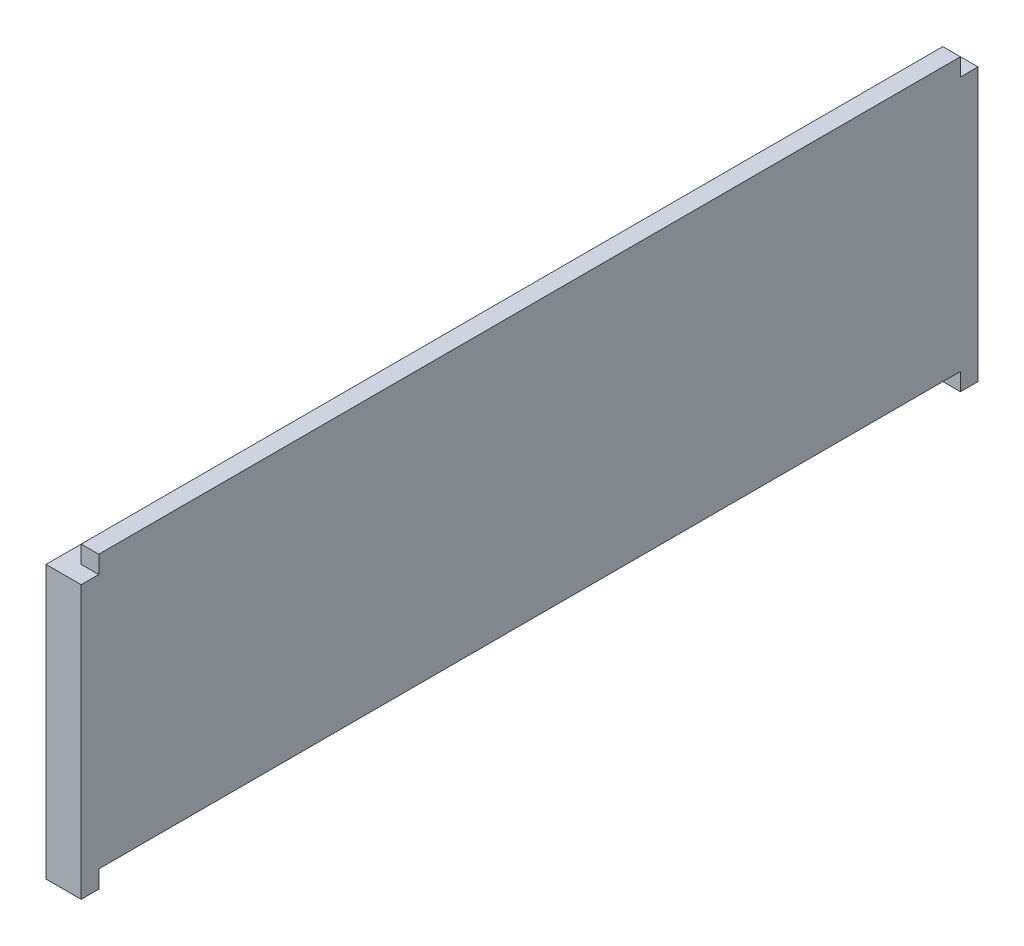
from build123d import *

# Parameters (mm, degrees)
EXTRUDE_1_DEPTH     = 490
SKETCH_2_W          = 20
SKETCH_2_H          = 165
EXTRUDE_2_DEPTH     = 10
SKETCH_3_W          = 20
SKETCH_3_H          = 165
EXTRUDE_3_DEPTH     = 10
SKETCH_4_W          = 10
SKETCH_4_H          = 10
CUT_EXTRUDE_1_DEPTH = 527.901319034


with BuildPart() as part:
    # Эскиз1 → Бобышка-Вытянуть1 (new body)
    with BuildSketch(Plane.XY):
        Polygon((0, 0), (0, 155), (10, 155), (10, 165), (20, 165), (20, 10), (10, 10), (10, 0), align=None)
    extrude(amount=EXTRUDE_1_DEPTH)

    # Эскиз2 → Бобышка-Вытянуть2 (add)
    with BuildSketch(Plane.XY.offset(490)):
        with Locations((10, 82.5)):
            Rectangle(SKETCH_2_W, SKETCH_2_H)
    extrude(amount=EXTRUDE_2_DEPTH)

    # Эскиз3 → Бобышка-Вытянуть3 (add)
    with BuildSketch(Plane(origin=(0, 0, 0), x_dir=(-1, 0, 0), z_dir=(0, 0, -1))):
        with Locations((-10, 82.5)):
            Rectangle(SKETCH_3_W, SKETCH_3_H)
    extrude(amount=EXTRUDE_3_DEPTH)

    # Эскиз4 → Вырез-Вытянуть1 (cut, through all)
    with BuildSketch(Plane(origin=(20, 0, 0), x_dir=(0, 0, -1), z_dir=(1, 0, 0))):
        with Locations((-495, 160)):
            Rectangle(SKETCH_4_W, SKETCH_4_H)
        with Locations((5, 160)):
            Rectangle(SKETCH_4_W, SKETCH_4_H)
    extrude(amount=-CUT_EXTRUDE_1_DEPTH, mode=Mode.SUBTRACT)


solid = part.part
